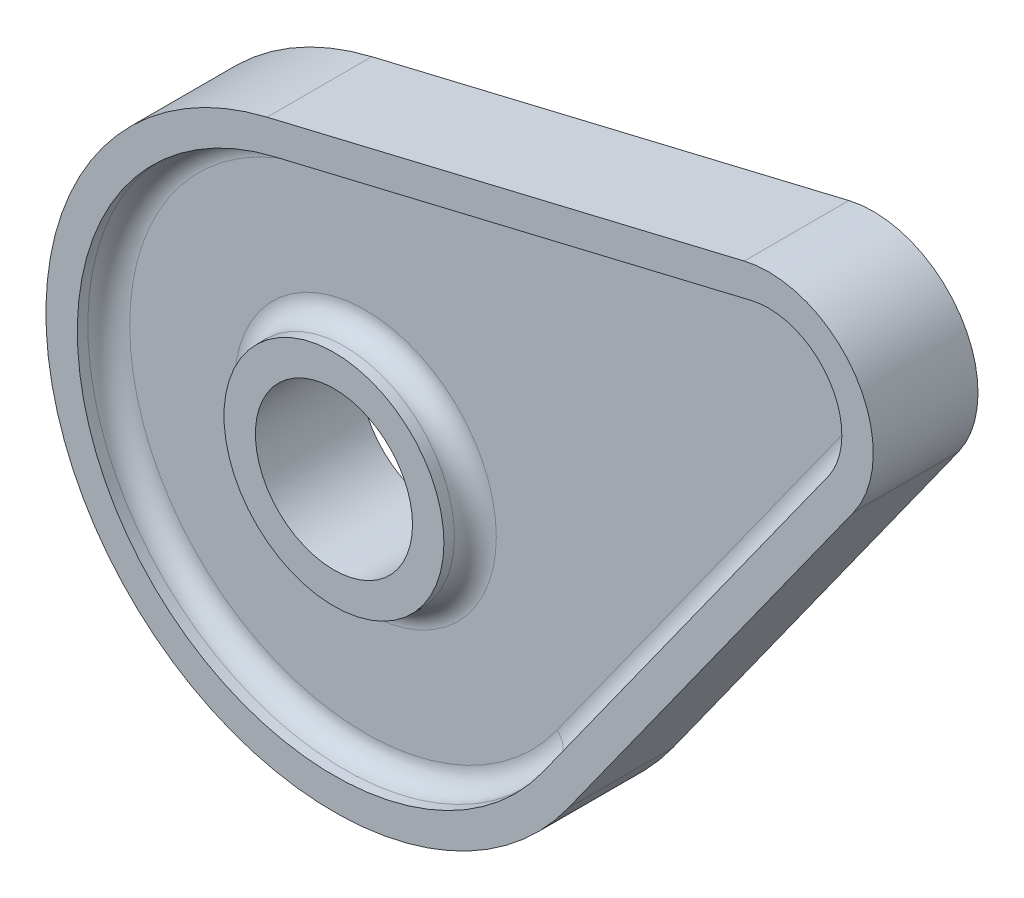
from build123d import *

# Parameters (mm, degrees)
SKETCH2_R           = 7.5
BOSS_EXTRUDE1_DEPTH = 10
SKETCH3_R           = 10.5
CUT_EXTRUDE1_DEPTH  = 3
CUT_EXTRUDE2_START  = -3
SKETCH4_R           = 10.5
CUT_EXTRUDE2_DEPTH  = 3
FILLET1_R           = 2


with BuildPart() as part:
    # Sketch2 → Boss-Extrude1 (new body)
    with BuildSketch(Plane.XY.offset(13)):
        with BuildLine():
            Line((-20.832934418, 37.628991133), (-66.388883934, 26.747563666))
            ThreePointArc((-66.388883934, 26.747563666), (-82.819662857, -15.34643239), (-37.637352066, -16.005060993))
            Line((-37.637352066, -16.005060993), (-10.377831921, 22.082582166))
            ThreePointArc((-10.377831921, 22.082582166), (-10.211644676, 33.483125214), (-20.832934418, 37.628991133))
        make_face()
        with Locations((-60, 0)):
            Circle(SKETCH2_R, mode=Mode.SUBTRACT)
    extrude(amount=BOSS_EXTRUDE1_DEPTH)

    # Sketch3 → Cut-Extrude1 (cut)
    with BuildSketch(Plane.XY.offset(23)):
        with BuildLine():
            Line((-20.135965261, 34.711075097), (-65.691914777, 23.82964763))
            ThreePointArc((-65.691914777, 23.82964763), (-80.330245091, -13.672276129), (-40.076913659, -14.25905434))
            Line((-40.076913659, -14.25905434), (-12.817393513, 23.82858882))
            ThreePointArc((-12.817393513, 23.82858882), (-12.701062442, 31.808968954), (-20.135965261, 34.711075097))
        make_face()
        with Locations((-60, 0)):
            Circle(SKETCH3_R, mode=Mode.SUBTRACT)
    extrude(amount=-CUT_EXTRUDE1_DEPTH, mode=Mode.SUBTRACT)

    # Sketch4 → Cut-Extrude2 (cut)
    with BuildSketch(Plane(origin=(0, 0, 13), x_dir=(-1, 0, 0), z_dir=(0, 0, -1)).offset(CUT_EXTRUDE2_START)):
        with BuildLine():
            Line((65.691914777, 23.82964763), (20.135965261, 34.711075097))
            ThreePointArc((20.135965261, 34.711075097), (12.701062442, 31.808968954), (12.817393513, 23.82858882))
            Line((12.817393513, 23.82858882), (40.076913659, -14.25905434))
            ThreePointArc((40.076913659, -14.25905434), (80.330245091, -13.672276129), (65.691914777, 23.82964763))
        make_face()
        with Locations(Location((60, 0, 0), (0, 0, 180))):
            Circle(SKETCH4_R, mode=Mode.SUBTRACT)
    extrude(amount=CUT_EXTRUDE2_DEPTH, mode=Mode.SUBTRACT)

    # Fillet1
    fillet1_edges = [part.edges().sort_by_distance(p)[0] for p in [
        (-42.913940019, 29.270361363, 20),
        (-12.701062442, 31.808968954, 20),
        (-26.447153586, 4.78476724, 20),
        (-80.330245091, -13.672276129, 20),
        (-70.5, 0, 20),
        (-12.701062442, 31.808968954, 16),
        (-42.913940019, 29.270361363, 16),
        (-80.330245091, -13.672276129, 16),
        (-26.447153586, 4.78476724, 16),
        (-70.5, 0, 16),
    ]]
    fillet(fillet1_edges, radius=FILLET1_R)


solid = part.part
